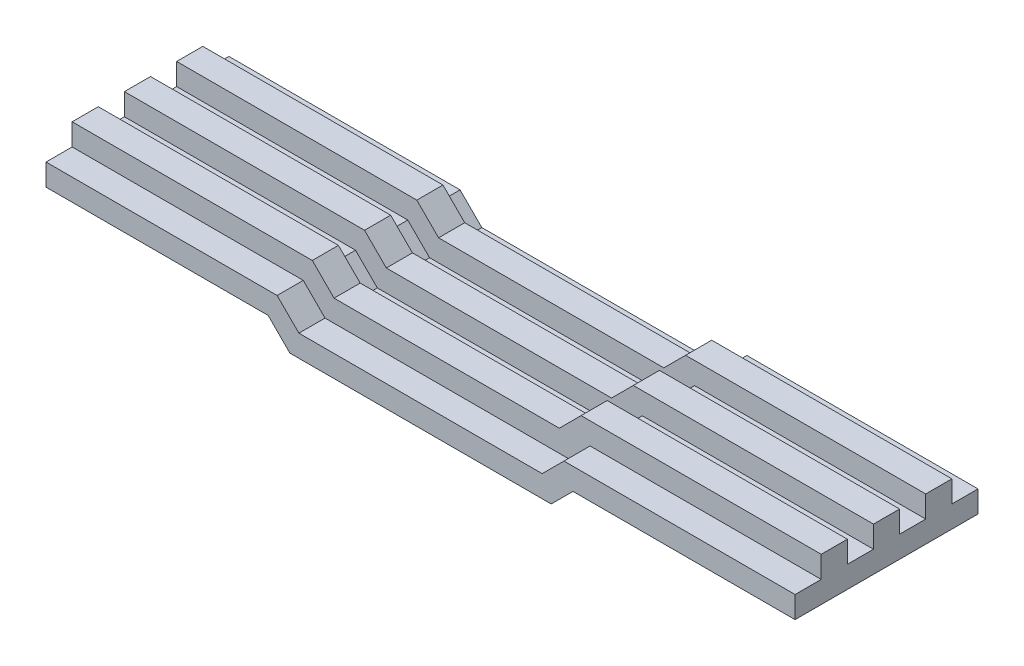
from build123d import *


with BuildPart() as part:
    # Sweep1: sweep along a path in Sketch2
    with BuildLine(Plane.XY) as sweep1_path:
        Line((-43, 2.5), (-17.5, 2.5))
        Line((-17.5, 2.5), (-15, 0))
        Line((-15, 0), (15, 0))
        Line((15, 0), (17.5, 2.5))
        Line((17.5, 2.5), (43, 2.5))
    # Sketch1 → Sweep1 (sweep)
    with BuildSketch(Plane(origin=(0, 0, 0), x_dir=(0, 0, -1), z_dir=(1, 0, 0))):
        Polygon((10.5, 0), (-10.5, 0), (-10.5, 2.5), (-7.5, 2.5), (-7.5, 5), (-4.5, 5), (-4.5, 2.5), (-1.5, 2.5), (-1.5, 5), (1.5, 5), (1.5, 2.5), (4.5, 2.5), (4.5, 5), (7.5, 5), (7.5, 2.5), (10.5, 2.5), align=None)
    sweep(path=sweep1_path.line, transition=Transition.RIGHT)


solid = part.part
